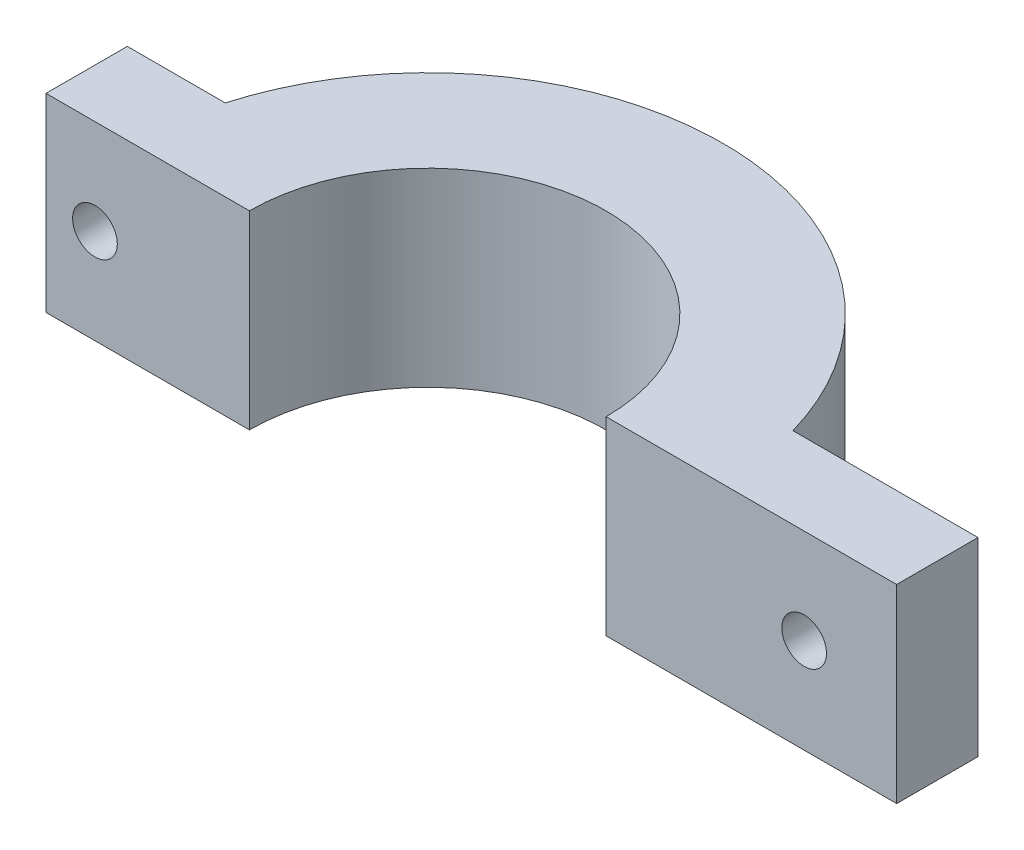
from build123d import *

# Parameters (mm, degrees)
SKETCH_1_W               = 51.5
SKETCH_1_H               = 34.15
SKETCH_1_W_2             = 31.5
SKETCH_1_H_2             = 14.15
EXTRUDE_1_DEPTH          = 12.25
SKETCH_2_R               = 1.91
CUT_EXTRUDE_1_DEPTH      = 34.236736076
SKETCH_4_W               = 13
SKETCH_4_H               = 13.91
EXTRUDE_1_2_DEPTH        = 74.82
SKETCH_5_W               = 13.91
SKETCH_5_H               = 16.23
EXTRUDE_2_DEPTH          = 16
SKETCH_7_R               = 25.25
SKETCH_7_R_2             = 15.25
EXTRUDE_2_2_DEPTH        = 16.23
SKETCH_15_R              = 1.91
CUT_EXTRUDE_6_DEPTH      = 97.964478439
SKETCH_16_W              = 13.91
SKETCH_16_H              = 16.23
EXTRUDE_4_DEPTH          = 10
SKETCH_17_R              = 1.91
CUT_EXTRUDE_7_DEPTH      = 102.16913771
CUT_EXTRUDE_8_DEPTH      = 83
CUT_EXTRUDE_8_DEPTH_BACK = 41
SKETCH_19_W              = 96.544544687
SKETCH_19_H              = 28.426665618
SKETCH_21_W              = 18.566153186
SKETCH_21_H              = 50.693982062
CUT_EXTRUDE_10_DEPTH     = 57
SKETCH_22_W              = 13
SKETCH_22_H              = 6.955
CUT_EXTRUDE_11_DEPTH     = 57


with BuildPart() as part:
    # 草圖1 → Extrude 1 (new body)
    with BuildSketch(Plane(origin=(0, 0, 0), x_dir=(1, 0, 0), z_dir=(0, 1, 0))):
        Rectangle(SKETCH_1_W, SKETCH_1_H)
        Rectangle(SKETCH_1_W_2, SKETCH_1_H_2, mode=Mode.SUBTRACT)
    extrude(amount=EXTRUDE_1_DEPTH)

    # 草圖2 → 除料-伸長1 (cut, through all)
    with BuildSketch(Plane(origin=(0, 12.25, 0), x_dir=(1, 0, 0), z_dir=(0, 1, 0))):
        with Locations(Location((-20.75, 0, 0), (0, 0, 270))):
            Circle(SKETCH_2_R)
        with Locations(Location((20.75, 0, 0), (0, 0, 270))):
            Circle(SKETCH_2_R)
    extrude(amount=-CUT_EXTRUDE_1_DEPTH, mode=Mode.SUBTRACT)

    # 草圖4 → Extrude 1 2 (add)
    with BuildSketch(Plane.XZ):
        with Locations((19.25, 0)):
            Rectangle(SKETCH_4_W, SKETCH_4_H)
    extrude(amount=EXTRUDE_1_2_DEPTH)

    # 草圖5 → Extrude 2 (add)
    with BuildSketch(Plane.ZY.offset(-12.75)):
        with Locations((0, -66.705)):
            Rectangle(SKETCH_5_W, SKETCH_5_H)
    extrude(amount=EXTRUDE_2_DEPTH)

    # 草圖7 → Extrude 2 2 (add)
    with BuildSketch(Plane(origin=(3.626674765, -74.82, 0), x_dir=(1, 0, 0), z_dir=(0, -1, 0))):
        with Locations((-30.978154344, 0)):
            Circle(SKETCH_7_R)
        with Locations((-30.978154344, 0)):
            Circle(SKETCH_7_R_2, mode=Mode.SUBTRACT)
    extrude(amount=-EXTRUDE_2_2_DEPTH)

    # 草圖15 → 除料-伸長6 (cut, through all)
    with BuildSketch(Plane(origin=(0, 0, -6.955), x_dir=(-1, 0, 0), z_dir=(0, 0, -1))):
        with Locations((-4.835883248, -66.705)):
            Circle(SKETCH_15_R)
    extrude(amount=-CUT_EXTRUDE_6_DEPTH, mode=Mode.SUBTRACT)

    # 草圖16 → 填料-伸長4 (add)
    with BuildSketch(Plane(origin=(-60, 0, 0), x_dir=(0, 0, -1), z_dir=(1, 0, 0))):
        with Locations((0, -66.705)):
            Rectangle(SKETCH_16_W, SKETCH_16_H)
    extrude(amount=EXTRUDE_4_DEPTH)

    # 草圖17 → 除料-伸長7 (cut, through all)
    with BuildSketch(Plane(origin=(0, 0, -6.955), x_dir=(-1, 0, 0), z_dir=(0, 0, -1))):
        with Locations((55.812362827, -66.705)):
            Circle(SKETCH_17_R)
    extrude(amount=-CUT_EXTRUDE_7_DEPTH, mode=Mode.SUBTRACT)

    # 草圖19 → 除料-伸長8 (cut, two sides: drawn at the far end of the back side and taken through both)
    with BuildSketch(Plane(origin=(0, -58.59, 0), x_dir=(1, 0, 0), z_dir=(0, 1, 0)).offset(-CUT_EXTRUDE_8_DEPTH_BACK)):
        with Locations((-11.727727657, -14.213332809)):
            Rectangle(SKETCH_19_W, SKETCH_19_H)
    extrude(amount=CUT_EXTRUDE_8_DEPTH + CUT_EXTRUDE_8_DEPTH_BACK, mode=Mode.SUBTRACT)

    # 草圖21 → 除料-伸長10 (cut)
    with BuildSketch(Plane(origin=(25.75, 0, 0), x_dir=(0, 0, -1), z_dir=(1, 0, 0))):
        with Locations((9.283076593, -10.889301771)):
            Rectangle(SKETCH_21_W, SKETCH_21_H)
    extrude(amount=-CUT_EXTRUDE_10_DEPTH, mode=Mode.SUBTRACT)

    # 草圖22 → 除料-伸長11 (cut)
    with BuildSketch(Plane(origin=(0, -36.236292802, 0), x_dir=(1, 0, 0), z_dir=(0, 1, 0))):
        with Locations((19.25, 3.4775)):
            Rectangle(SKETCH_22_W, SKETCH_22_H)
    extrude(amount=-CUT_EXTRUDE_11_DEPTH, mode=Mode.SUBTRACT)


solid = part.part
